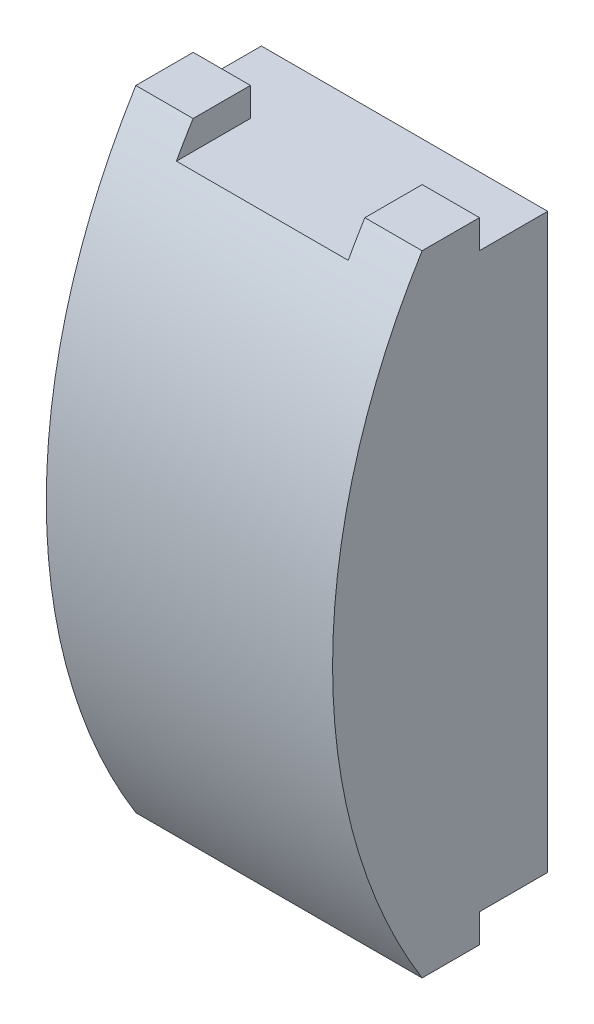
from build123d import *

# Parameters (mm, degrees)
SKETCH1_W           = 50
SKETCH1_H           = 100
BOSS_EXTRUDE1_DEPTH = 20
BOSS_EXTRUDE2_DEPTH = 50
SKETCH3_W           = 30
SKETCH3_H           = 5
CUT_EXTRUDE1_DEPTH  = 30


with BuildPart() as part:
    # Sketch1 → Boss-Extrude1 (new body)
    with BuildSketch(Plane.XY):
        Rectangle(SKETCH1_W, SKETCH1_H)
    extrude(amount=BOSS_EXTRUDE1_DEPTH)

    # Sketch2 → Boss-Extrude2 (add, through all)
    with BuildSketch(Plane(origin=(25, 0, 0), x_dir=(0, 0, -1), z_dir=(1, 0, 0))):
        with BuildLine():
            Line((-11.918313109, 55), (-11.918313109, -55))
            Line((-11.918313109, -55), (-21.936720316, -55))
            ThreePointArc((-21.936720316, -55), (-37.569706847, 0), (-21.936720316, 55))
            Line((-21.936720316, 55), (-11.918313109, 55))
        make_face()
    extrude(amount=-BOSS_EXTRUDE2_DEPTH)

    # Sketch3 → Cut-Extrude1 (cut)
    with BuildSketch(Plane(origin=(0, 0, 0), x_dir=(-1, 0, 0), z_dir=(0, 0, -1))):
        with Locations((0, 52.5)):
            Rectangle(SKETCH3_W, SKETCH3_H)
    extrude(amount=-CUT_EXTRUDE1_DEPTH, mode=Mode.SUBTRACT)


solid = part.part
